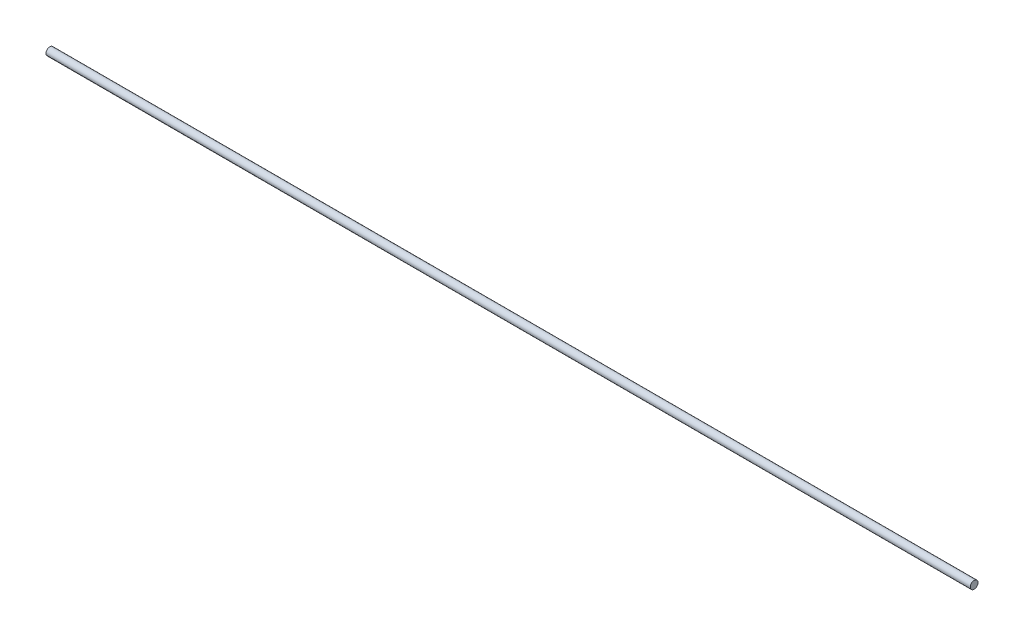
from build123d import *

# Parameters (mm, degrees)
SKETCH1_W = 60
SKETCH1_H = 0.25


with BuildPart() as part:
    # Sketch1 → Revolve1 (revolve)
    with BuildSketch(Plane(origin=(0, 0, 0), x_dir=(1, 0, 0), z_dir=(0, 1, 0)), mode=Mode.PRIVATE) as revolve1_sk:
        with Locations((1.497227357, 5.087569316)):
            Rectangle(SKETCH1_W, SKETCH1_H)
    revolve(revolve1_sk.sketch.rotate(Axis((-28.502772643, 0, -4.962569316), (1, 0, 0)), 180), axis=Axis((-28.502772643, 0, -4.962569316), (1, 0, 0)))


solid = part.part
